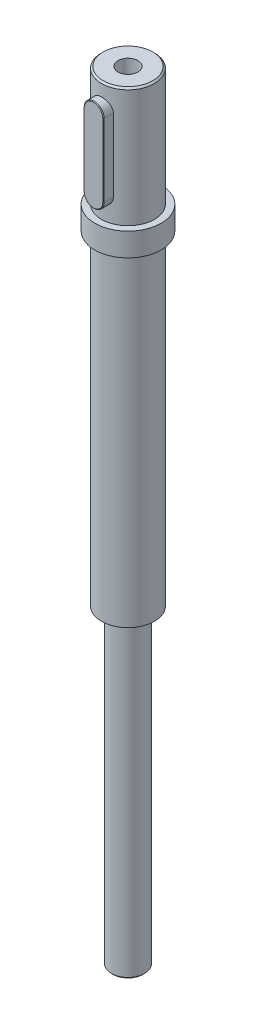
from build123d import *

# Parameters (mm, degrees)
SKETCH_1_R          = 2.5
EXTRUDE_1_DEPTH     = 47
EXTRUDE_START       = 47
SKETCH_2_R          = 4
EXTRUDE_2_DEPTH     = 49
EXTRUDE_START_2     = 96
SKETCH_3_R          = 5
EXTRUDE_3_DEPTH     = 3.5
EXTRUDE_START_3     = 99.5
SKETCH_4_R          = 4
EXTRUDE_4_DEPTH     = 18
EXTRUDE_START_4     = 2.2
EXTRUDE_5_DEPTH     = 3
CHAMFER_1_SIZE      = 0.25
CHAMFER_2_SIZE      = 0.1
CUT_EXTRUDE_START   = 117.5
SKETCH_6_R          = 1.5
CUT_EXTRUDE_1_DEPTH = 10


with BuildPart() as part:
    # 草图1 → 凸台-拉伸1 (new body)
    with BuildSketch(Plane(origin=(0, 0, 0), x_dir=(1, 0, 0), z_dir=(0, 1, 0))):
        with Locations(Location((0, 0, 0), (0, 0, 270))):
            Circle(SKETCH_1_R)
    extrude(amount=EXTRUDE_1_DEPTH)

    # 草图2 → 凸台-拉伸2 (add)
    with BuildSketch(Plane(origin=(0, 0, 0), x_dir=(1, 0, 0), z_dir=(0, 1, 0)).offset(EXTRUDE_START)):
        with Locations(Location((0, 0, 0), (0, 0, 270))):
            Circle(SKETCH_2_R)
    extrude(amount=EXTRUDE_2_DEPTH)

    # 草图3 → 凸台-拉伸3 (add)
    with BuildSketch(Plane(origin=(0, 0, 0), x_dir=(1, 0, 0), z_dir=(0, 1, 0)).offset(EXTRUDE_START_2)):
        with Locations(Location((0, 0, 0), (0, 0, 270))):
            Circle(SKETCH_3_R)
    extrude(amount=EXTRUDE_3_DEPTH)

    # 草图4 → 凸台-拉伸4 (add)
    with BuildSketch(Plane(origin=(0, 0, 0), x_dir=(1, 0, 0), z_dir=(0, 1, 0)).offset(EXTRUDE_START_3)):
        with Locations(Location((0, 0, 0), (0, 0, 270))):
            Circle(SKETCH_4_R)
    extrude(amount=EXTRUDE_4_DEPTH)

    # 草图11 → 凸台-拉伸5 (add)
    with BuildSketch(Plane.XY.offset(EXTRUDE_START_4)):
        with BuildLine():
            Line((-1.5, 103), (-1.5, 114))
            ThreePointArc((-1.5, 114), (0, 115.5), (1.5, 114))
            Line((1.5, 114), (1.5, 103))
            ThreePointArc((1.5, 103), (0, 101.5), (-1.5, 103))
        make_face()
    extrude(amount=EXTRUDE_5_DEPTH)

    # 倒角1
    chamfer_1_edges = [part.edges().sort_by_distance(p)[0] for p in [
        (0, 117.5, -4),
        (0, 0, -2.5),
    ]]
    chamfer(chamfer_1_edges, length=CHAMFER_1_SIZE)

    # 倒角2
    chamfer_2_edges = [part.edges().sort_by_distance(p)[0] for p in [
        (0, 101.5, 5.2),
        (1.5, 108.5, 5.2),
        (0, 115.5, 5.2),
        (-1.5, 108.5, 5.2),
    ]]
    chamfer(chamfer_2_edges, length=CHAMFER_2_SIZE)

    # 草图6 → 切除-拉伸1 (cut)
    with BuildSketch(Plane(origin=(0, 0, 0), x_dir=(1, 0, 0), z_dir=(0, 1, 0)).offset(CUT_EXTRUDE_START)):
        with Locations(Location((0, 0, 0), (0, 0, 270))):
            Circle(SKETCH_6_R)
    extrude(amount=-CUT_EXTRUDE_1_DEPTH, mode=Mode.SUBTRACT)


solid = part.part
